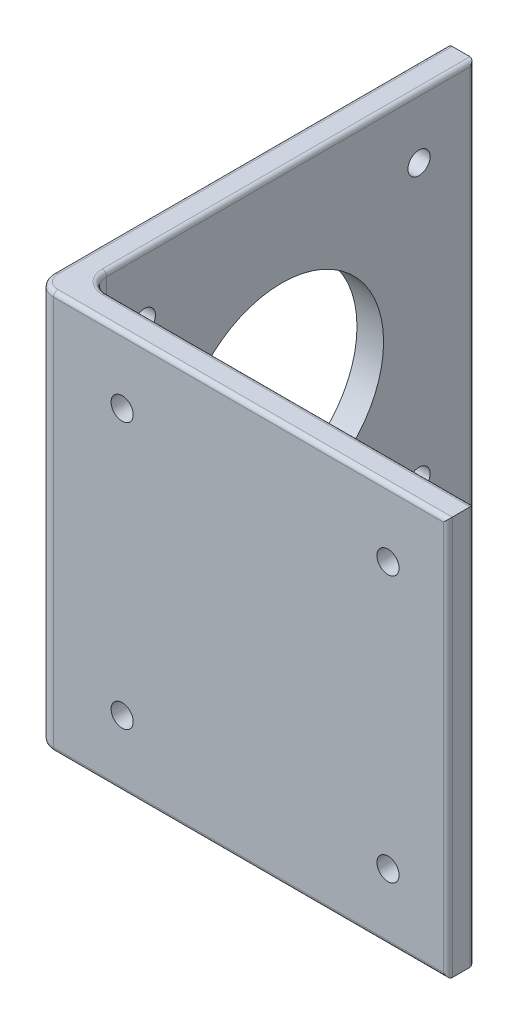
from build123d import *

# Parameters (mm, degrees)
EXTRUDE_1_DEPTH     = 45
M3X0_5_1_D          = 2.5
FILLET_1_R          = 2
M3X0_5_2_D          = 2.5
FILLET_2_R          = 0.5
CUT_EXTRUDE_1_REACH = 69.032
SKETCH_6_R          = 11.5


with BuildPart() as part:
    # 草图1 → 拉伸-薄壁1 (new body)
    with BuildSketch(Plane(origin=(0, 0, 0), x_dir=(1, 0, 0), z_dir=(0, 1, 0))):
        Polygon((-24, 22.5), (-24, -24), (22.5, -24), (22.5, -21), (-21, -21), (-21, 22.5), align=None)
    extrude(amount=EXTRUDE_1_DEPTH)

    # M3x0.5 螺纹孔1 (through all)
    with Locations(Plane(origin=(-21, 38, 14.75), x_dir=(0, 0, 1), z_dir=(1, 0, 0))):
        with Locations((0, 0), (-31, 0), (-31, 31), (0, 31)):
            Hole(M3X0_5_1_D / 2)

    # 圆角1
    fillet_1_edges = [part.edges().sort_by_distance(p)[0] for p in [
        (-24, 22.5, 24),
        (-21, 22.5, 21),
    ]]
    fillet(fillet_1_edges, radius=FILLET_1_R)

    # M3x0.5 螺纹孔2 (through all)
    with Locations(Plane(origin=(-14.25, 37.5, 21), x_dir=(-1, 0, 0), z_dir=(0, 0, -1))):
        with Locations((0, 0), (0, -30), (-30, -30), (-30, 0)):
            Hole(M3X0_5_2_D / 2)

    # 圆角2
    fillet_2_edges = [part.edges().sort_by_distance(p)[0] for p in [
        (22.5, 22.5, 24),
        (-21, 45, -1.75),
        (-24, 45, -0.25),
        (0.25, 0, 24),
        (0.25, 45, 24),
        (1.75, 0, 21),
        (-23.414213562, 0, 23.414213562),
        (1.75, 45, 21),
        (-23.414213562, 45, 23.414213562),
        (-20.414213562, 0, 20.414213562),
        (-20.414213562, 45, 20.414213562),
        (-24, 0, -0.25),
        (-21, 0, -1.75),
        (-24, 22.5, -22.5),
        (-21, 22.5, -22.5),
        (22.5, 22.5, 21),
    ]]
    fillet(fillet_2_edges, radius=FILLET_2_R)

    # 草图6 → 切除-拉伸1 (cut, up to next)
    with BuildSketch(Plane(origin=(-21, 0, 0), x_dir=(0, 0, -1), z_dir=(1, 0, 0)), mode=Mode.PRIVATE) as cut_extrude_1_sk1:
        with Locations((0.75, 22.5)):
            Circle(SKETCH_6_R)
    cut_extrude_1_tool1 = extrude(cut_extrude_1_sk1.sketch, amount=-CUT_EXTRUDE_1_REACH, mode=Mode.PRIVATE) & part.part
    add(cut_extrude_1_tool1.solids().sort_by_distance((-21, 22.5, -0.75))[0], mode=Mode.SUBTRACT)


solid = part.part
